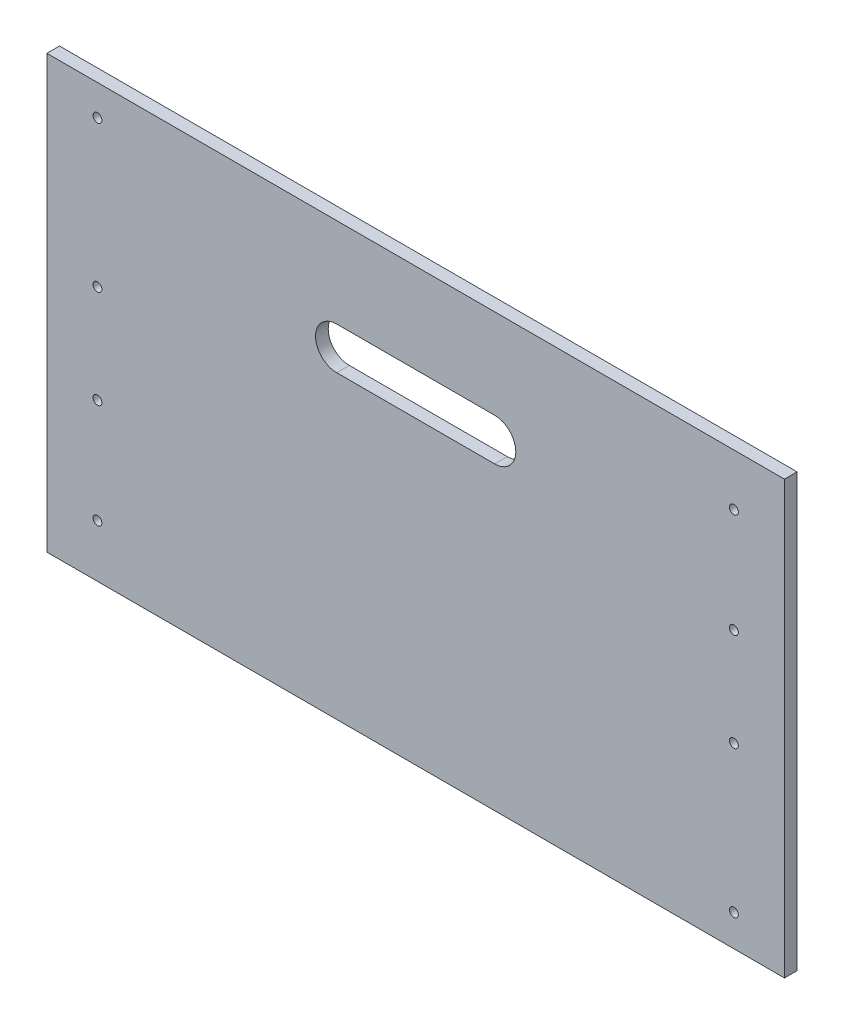
from build123d import *

# Parameters (mm, degrees)
ESBO_O1_W                    = 350
ESBO_O1_H                    = 205
RESSALTO_EXTRUS_O1_DEPTH     = 6
CORTE_EXTRUS_O1_DEPTH        = 203.897141429
FURO_DE_DI_METRO_4_2_4_2_1_D = 4.2


with BuildPart() as part:
    # Esboço1 → Ressalto-extrusão1 (new body)
    with BuildSketch(Plane.XY):
        Rectangle(ESBO_O1_W, ESBO_O1_H)
    extrude(amount=RESSALTO_EXTRUS_O1_DEPTH)

    # Esboço2 → Corte-extrusão1 (cut, through all)
    with BuildSketch(Plane.XY.offset(6)):
        with BuildLine():
            Line((-37.5, 60), (37.5, 60))
            ThreePointArc((37.5, 60), (47.5, 50), (37.5, 40))
            Line((37.5, 40), (-37.5, 40))
            ThreePointArc((-37.5, 40), (-47.5, 50), (-37.5, 60))
        make_face()
    extrude(amount=-CORTE_EXTRUS_O1_DEPTH, mode=Mode.SUBTRACT)

    # Furo de diâmetro Ø4.2 (4.2)1 (through all)
    with Locations(Plane(origin=(0, 0, 0), x_dir=(-1, 0, 0), z_dir=(0, 0, -1))):
        with Locations((-151, -87.5), (-151, -18), (-151, 28.5), (-151, 78), (151, -77.5), (151, -28), (151, 18.5), (151, 88)):
            Hole(FURO_DE_DI_METRO_4_2_4_2_1_D / 2)


solid = part.part
